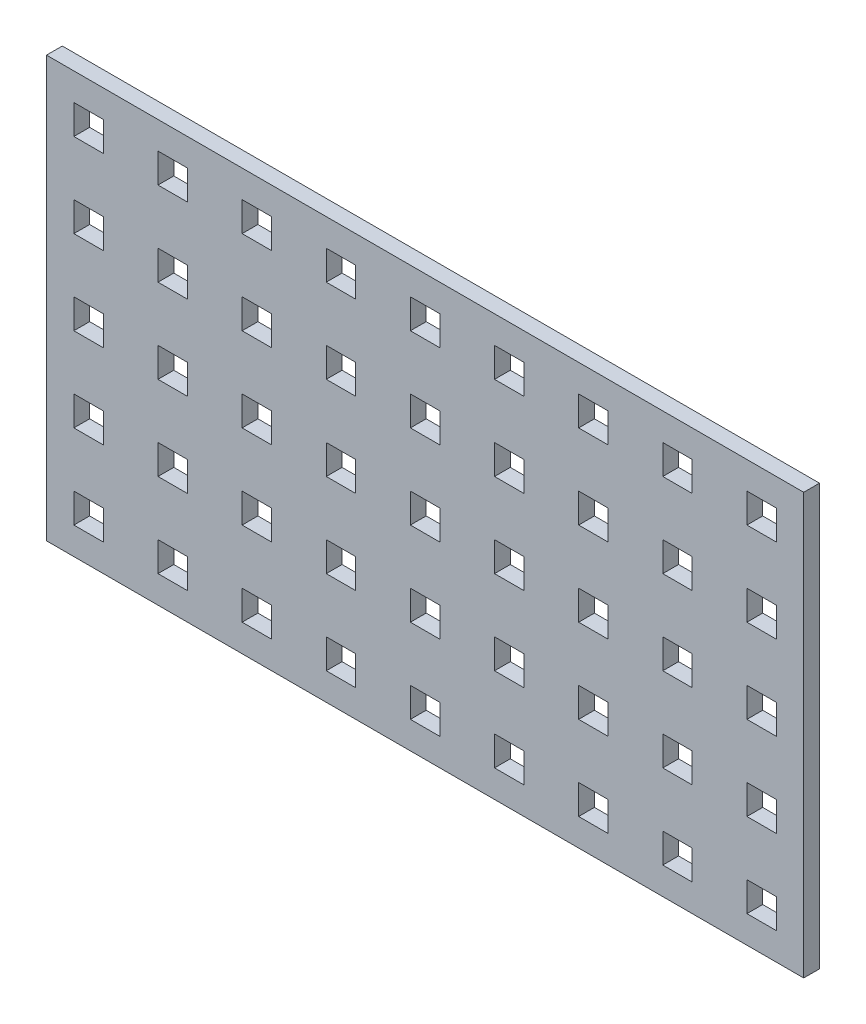
from build123d import *

# Parameters (mm, degrees)
ESBO_O1_W                = 72
ESBO_O1_H                = 40
ESBO_O1_W_2              = 2.8
ESBO_O1_H_2              = 2.8
RESSALTO_EXTRUS_O1_DEPTH = 1.5


with BuildPart() as part:
    # Esboço1 → Ressalto-extrusão1 (new body)
    with BuildSketch(Plane.XY):
        Rectangle(ESBO_O1_W, ESBO_O1_H)
        with Locations((-32, 16)):
            Rectangle(ESBO_O1_W_2, ESBO_O1_H_2, mode=Mode.SUBTRACT)
        with Locations((-24, 16)):
            Rectangle(ESBO_O1_W_2, ESBO_O1_H_2, mode=Mode.SUBTRACT)
        with Locations((-24, 8)):
            Rectangle(ESBO_O1_W_2, ESBO_O1_H_2, mode=Mode.SUBTRACT)
        with Locations((32, 16)):
            Rectangle(ESBO_O1_W_2, ESBO_O1_H_2, mode=Mode.SUBTRACT)
        with Locations((-32, 8)):
            Rectangle(ESBO_O1_W_2, ESBO_O1_H_2, mode=Mode.SUBTRACT)
        with Locations((32, 8)):
            Rectangle(ESBO_O1_W_2, ESBO_O1_H_2, mode=Mode.SUBTRACT)
        with Locations((-32, 0)):
            Rectangle(ESBO_O1_W_2, ESBO_O1_H_2, mode=Mode.SUBTRACT)
        with Locations((32, 0)):
            Rectangle(ESBO_O1_W_2, ESBO_O1_H_2, mode=Mode.SUBTRACT)
        with Locations((-32, -8)):
            Rectangle(ESBO_O1_W_2, ESBO_O1_H_2, mode=Mode.SUBTRACT)
        with Locations((32, -8)):
            Rectangle(ESBO_O1_W_2, ESBO_O1_H_2, mode=Mode.SUBTRACT)
        with Locations((-32, -16)):
            Rectangle(ESBO_O1_W_2, ESBO_O1_H_2, mode=Mode.SUBTRACT)
        with Locations((32, -16)):
            Rectangle(ESBO_O1_W_2, ESBO_O1_H_2, mode=Mode.SUBTRACT)
        with Locations((-24, 0)):
            Rectangle(ESBO_O1_W_2, ESBO_O1_H_2, mode=Mode.SUBTRACT)
        with Locations((-24, -8)):
            Rectangle(ESBO_O1_W_2, ESBO_O1_H_2, mode=Mode.SUBTRACT)
        with Locations((-24, -16)):
            Rectangle(ESBO_O1_W_2, ESBO_O1_H_2, mode=Mode.SUBTRACT)
        with Locations((-16, 16)):
            Rectangle(ESBO_O1_W_2, ESBO_O1_H_2, mode=Mode.SUBTRACT)
        with Locations((-16, 8)):
            Rectangle(ESBO_O1_W_2, ESBO_O1_H_2, mode=Mode.SUBTRACT)
        with Locations((-16, 0)):
            Rectangle(ESBO_O1_W_2, ESBO_O1_H_2, mode=Mode.SUBTRACT)
        with Locations((-16, -8)):
            Rectangle(ESBO_O1_W_2, ESBO_O1_H_2, mode=Mode.SUBTRACT)
        with Locations((-16, -16)):
            Rectangle(ESBO_O1_W_2, ESBO_O1_H_2, mode=Mode.SUBTRACT)
        with Locations((-8, 16)):
            Rectangle(ESBO_O1_W_2, ESBO_O1_H_2, mode=Mode.SUBTRACT)
        with Locations((-8, 8)):
            Rectangle(ESBO_O1_W_2, ESBO_O1_H_2, mode=Mode.SUBTRACT)
        with Locations((-8, 0)):
            Rectangle(ESBO_O1_W_2, ESBO_O1_H_2, mode=Mode.SUBTRACT)
        with Locations((-8, -8)):
            Rectangle(ESBO_O1_W_2, ESBO_O1_H_2, mode=Mode.SUBTRACT)
        with Locations((-8, -16)):
            Rectangle(ESBO_O1_W_2, ESBO_O1_H_2, mode=Mode.SUBTRACT)
        with Locations((0, 16)):
            Rectangle(ESBO_O1_W_2, ESBO_O1_H_2, mode=Mode.SUBTRACT)
        with Locations((0, 8)):
            Rectangle(ESBO_O1_W_2, ESBO_O1_H_2, mode=Mode.SUBTRACT)
        Rectangle(ESBO_O1_W_2, ESBO_O1_H_2, mode=Mode.SUBTRACT)
        with Locations((0, -8)):
            Rectangle(ESBO_O1_W_2, ESBO_O1_H_2, mode=Mode.SUBTRACT)
        with Locations((0, -16)):
            Rectangle(ESBO_O1_W_2, ESBO_O1_H_2, mode=Mode.SUBTRACT)
        with Locations((8, 16)):
            Rectangle(ESBO_O1_W_2, ESBO_O1_H_2, mode=Mode.SUBTRACT)
        with Locations((8, 8)):
            Rectangle(ESBO_O1_W_2, ESBO_O1_H_2, mode=Mode.SUBTRACT)
        with Locations((8, 0)):
            Rectangle(ESBO_O1_W_2, ESBO_O1_H_2, mode=Mode.SUBTRACT)
        with Locations((8, -8)):
            Rectangle(ESBO_O1_W_2, ESBO_O1_H_2, mode=Mode.SUBTRACT)
        with Locations((8, -16)):
            Rectangle(ESBO_O1_W_2, ESBO_O1_H_2, mode=Mode.SUBTRACT)
        with Locations((16, 16)):
            Rectangle(ESBO_O1_W_2, ESBO_O1_H_2, mode=Mode.SUBTRACT)
        with Locations((16, 8)):
            Rectangle(ESBO_O1_W_2, ESBO_O1_H_2, mode=Mode.SUBTRACT)
        with Locations((16, 0)):
            Rectangle(ESBO_O1_W_2, ESBO_O1_H_2, mode=Mode.SUBTRACT)
        with Locations((16, -8)):
            Rectangle(ESBO_O1_W_2, ESBO_O1_H_2, mode=Mode.SUBTRACT)
        with Locations((16, -16)):
            Rectangle(ESBO_O1_W_2, ESBO_O1_H_2, mode=Mode.SUBTRACT)
        with Locations((24, 16)):
            Rectangle(ESBO_O1_W_2, ESBO_O1_H_2, mode=Mode.SUBTRACT)
        with Locations((24, 8)):
            Rectangle(ESBO_O1_W_2, ESBO_O1_H_2, mode=Mode.SUBTRACT)
        with Locations((24, 0)):
            Rectangle(ESBO_O1_W_2, ESBO_O1_H_2, mode=Mode.SUBTRACT)
        with Locations((24, -8)):
            Rectangle(ESBO_O1_W_2, ESBO_O1_H_2, mode=Mode.SUBTRACT)
        with Locations((24, -16)):
            Rectangle(ESBO_O1_W_2, ESBO_O1_H_2, mode=Mode.SUBTRACT)
    extrude(amount=RESSALTO_EXTRUS_O1_DEPTH)


solid = part.part
